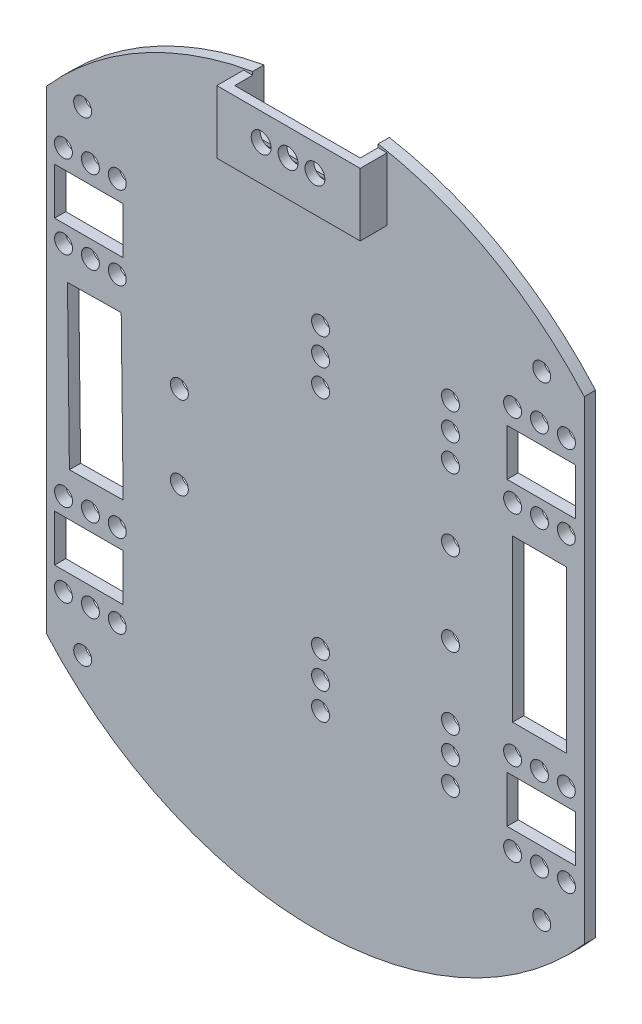
from build123d import *

# Parameters (mm, degrees)
SKETCH_1_R          = 80
EXTRUDE_1_DEPTH     = 2.5
SKETCH_2_W          = 100.60548239
SKETCH_2_H          = 145.735598162
CUT_EXTRUDE_1_DEPTH = 114.164702978
SKETCH_3_R          = 2
CUT_EXTRUDE_2_DEPTH = 101.031245119
SKETCH_4_R          = 2
SKETCH_4_W          = 15.232799914
SKETCH_4_H          = 10.431121385
SKETCH_4_W_2        = 11.994997095
SKETCH_4_H_2        = 36
CUT_EXTRUDE_3_DEPTH = 101.031245119
EXTRUDE_2_DEPTH     = 4
SKETCH_6_W          = 32
SKETCH_6_H          = 14.029347869
EXTRUDE_3_DEPTH     = 2
SKETCH_7_R          = 2.217818609
CUT_EXTRUDE_4_DEPTH = 3
SKETCH_8_W          = 28
SKETCH_8_H          = 15.27806524
CUT_EXTRUDE_5_DEPTH = 3


with BuildPart() as part:
    # 草圖1 → 填料-伸長1 (new body)
    with BuildSketch(Plane.XY):
        Circle(SKETCH_1_R)
    extrude(amount=EXTRUDE_1_DEPTH)

    # 草圖2 → 除料-伸長1 (cut, through all)
    with BuildSketch(Plane.XY.offset(2.5)):
        with Locations((110.302741195, -4.321910255)):
            Rectangle(SKETCH_2_W, SKETCH_2_H)
        with Locations((-110.302741195, -4.321910255)):
            Rectangle(SKETCH_2_W, SKETCH_2_H)
    extrude(amount=-CUT_EXTRUDE_1_DEPTH, mode=Mode.SUBTRACT)

    # 草圖3 → 除料-伸長2 (cut, through all)
    with BuildSketch(Plane.XY.offset(2.5)):
        with Locations((50.5, 53)):
            Circle(SKETCH_3_R)
        with Locations(Location((-51.940924548, 53, 0), (0, 0, 180))):
            Circle(SKETCH_3_R)
        with Locations(Location((50.5, -53, 0), (0, 0, 180))):
            Circle(SKETCH_3_R)
        with Locations((-51.940924548, -53)):
            Circle(SKETCH_3_R)
    extrude(amount=-CUT_EXTRUDE_2_DEPTH, mode=Mode.SUBTRACT)

    # 草圖4 → 除料-伸長3 (cut, through all)
    with BuildSketch(Plane.XY.offset(2.5)):
        with Locations((56.024944143, 42.913378777)):
            Circle(SKETCH_4_R)
        with Locations((50, 42.913378777)):
            Circle(SKETCH_4_R)
        with Locations((44, 42.913378777)):
            Circle(SKETCH_4_R)
        with Locations((55.994997095, 24.413403016)):
            Circle(SKETCH_4_R)
        with Locations((50, 24.413403016)):
            Circle(SKETCH_4_R)
        with Locations((44, 24.413403016)):
            Circle(SKETCH_4_R)
        with Locations((-30.354317412, 9.25)):
            Circle(SKETCH_4_R)
        with Locations(Location((30.145682588, 9.25, 0), (0, 0, 180))):
            Circle(SKETCH_4_R)
        with Locations((30.145682588, -9.25)):
            Circle(SKETCH_4_R)
        with Locations(Location((-30.354317412, -9.25, 0), (0, 0, 180))):
            Circle(SKETCH_4_R)
        with Locations((30.145682588, -25.25)):
            Circle(SKETCH_4_R)
        with Locations((30.145682588, -31.25)):
            Circle(SKETCH_4_R)
        with Locations((30.145682588, -37.25)):
            Circle(SKETCH_4_R)
        with Locations(Location((1.145682588, 37.25, 0), (0, 0, 180))):
            Circle(SKETCH_4_R)
        with Locations(Location((1.145682588, 31.25, 0), (0, 0, 180))):
            Circle(SKETCH_4_R)
        with Locations(Location((1.145682588, 25.25, 0), (0, 0, 180))):
            Circle(SKETCH_4_R)
        with Locations((1.145682588, -25.25)):
            Circle(SKETCH_4_R)
        with Locations((1.145682588, -31.25)):
            Circle(SKETCH_4_R)
        with Locations((1.145682588, -37.25)):
            Circle(SKETCH_4_R)
        with Locations(Location((30.145682588, 37.25, 0), (0, 0, 180))):
            Circle(SKETCH_4_R)
        with Locations(Location((30.145682588, 31.25, 0), (0, 0, 180))):
            Circle(SKETCH_4_R)
        with Locations(Location((30.145682588, 25.25, 0), (0, 0, 180))):
            Circle(SKETCH_4_R)
        with Locations(Location((44, -42.913378777, 0), (0, 0, 180))):
            Circle(SKETCH_4_R)
        with Locations(Location((50, -42.913378777, 0), (0, 0, 180))):
            Circle(SKETCH_4_R)
        with Locations(Location((56.024944143, -42.913378777, 0), (0, 0, 180))):
            Circle(SKETCH_4_R)
        with Locations(Location((55.994997095, -24.413403016, 0), (0, 0, 180))):
            Circle(SKETCH_4_R)
        with Locations(Location((50, -24.413403016, 0), (0, 0, 180))):
            Circle(SKETCH_4_R)
        with Locations(Location((44, -24.413403016, 0), (0, 0, 180))):
            Circle(SKETCH_4_R)
        with Locations(Location((-44.208634825, 24.413403016, 0), (0, 0, 180))):
            Circle(SKETCH_4_R)
        with Locations(Location((-50.208634825, 24.413403016, 0), (0, 0, 180))):
            Circle(SKETCH_4_R)
        with Locations(Location((-56.20363192, 24.413403016, 0), (0, 0, 180))):
            Circle(SKETCH_4_R)
        with Locations(Location((-44.208634825, 42.913378777, 0), (0, 0, 180))):
            Circle(SKETCH_4_R)
        with Locations(Location((-50.208634825, 42.913378777, 0), (0, 0, 180))):
            Circle(SKETCH_4_R)
        with Locations(Location((-56.233578968, 42.913378777, 0), (0, 0, 180))):
            Circle(SKETCH_4_R)
        with Locations((-44.208634825, -24.413403016)):
            Circle(SKETCH_4_R)
        with Locations((-50.208634825, -24.413403016)):
            Circle(SKETCH_4_R)
        with Locations((-56.20363192, -24.413403016)):
            Circle(SKETCH_4_R)
        with Locations((-56.233578968, -42.913378777)):
            Circle(SKETCH_4_R)
        with Locations((-50.208634825, -42.913378777)):
            Circle(SKETCH_4_R)
        with Locations((-44.208634825, -42.913378777)):
            Circle(SKETCH_4_R)
        with Locations((50.378597138, 33.525369531)):
            Rectangle(SKETCH_4_W, SKETCH_4_H)
        Polygon((-55.327205732, 17.335052239), (-54.897151983, -18.662378972), (-42.903010794, -18.519087487), (-43.333064544, 17.478343724), align=None)
        with Locations((49.997498548, 0)):
            Rectangle(SKETCH_4_W_2, SKETCH_4_H_2)
        with Locations((50.378597138, -33.525369531)):
            Rectangle(SKETCH_4_W, SKETCH_4_H)
        with Locations((-50.587231963, 33.525369531)):
            Rectangle(SKETCH_4_W, SKETCH_4_H)
        with Locations((-50.587231963, -33.525369531)):
            Rectangle(SKETCH_4_W, SKETCH_4_H)
    extrude(amount=-CUT_EXTRUDE_3_DEPTH, mode=Mode.SUBTRACT)

    # 草圖5 → 填料-伸長2 (add)
    with BuildSketch(Plane.XY.offset(2.5)):
        Polygon((14, 78.029347869), (16, 78.029347869), (16, 66), (16, 64), (-16, 64), (-16, 66), (-16, 78.029347869), (-14, 78.029347869), (-14, 76), (-14, 66), (14, 66), (14, 76), align=None)
    extrude(amount=EXTRUDE_2_DEPTH)

    # 草圖6 → 填料-伸長3 (add)
    with BuildSketch(Plane.XY.offset(6.5)):
        with Locations((0, 71.014673934)):
            Rectangle(SKETCH_6_W, SKETCH_6_H)
    extrude(amount=EXTRUDE_3_DEPTH)

    # 草圖7 → 除料-伸長4 (cut)
    with BuildSketch(Plane.XY.offset(8.5)):
        with Locations((-0.104317412, 72)):
            Circle(SKETCH_7_R)
        with Locations((5.895682588, 72)):
            Circle(SKETCH_7_R)
        with Locations((-6.104317412, 72)):
            Circle(SKETCH_7_R)
    extrude(amount=-CUT_EXTRUDE_4_DEPTH, mode=Mode.SUBTRACT)

    # 草圖8 → 除料-伸長5 (cut)
    with BuildSketch(Plane(origin=(0, 0, 0), x_dir=(-1, 0, 0), z_dir=(0, 0, -1))):
        with Locations((0, 74.312512391)):
            Rectangle(SKETCH_8_W, SKETCH_8_H)
    extrude(amount=-CUT_EXTRUDE_5_DEPTH, mode=Mode.SUBTRACT)


solid = part.part
